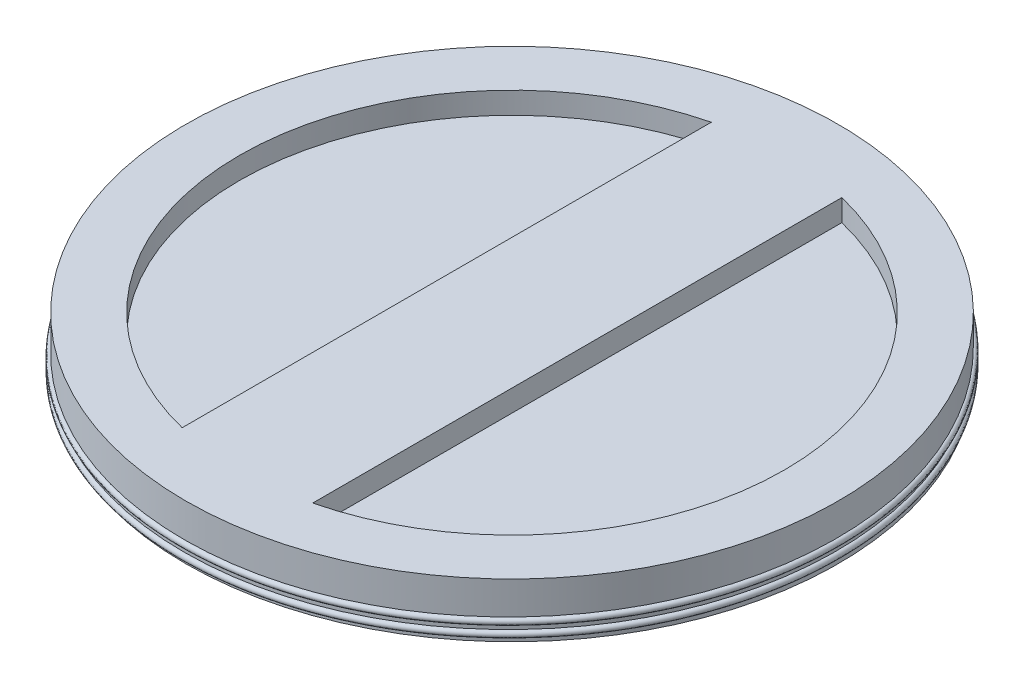
from build123d import *

# Parameters (mm, degrees)
SKETCH_1_R          = 30
EXTRUDE_1_DEPTH     = 5
CUT_EXTRUDE_1_DEPTH = 2
SWEEP_1_PITCH       = 1
SWEEP_1_HEIGHT      = 2
SWEEP_1_RADIUS      = 30
SWEEP_1_START_ANGLE = -90
SKETCH_5_R          = 0.3


with BuildPart() as part:
    # 草图1 → 凸台-拉伸1 (new body)
    with BuildSketch(Plane(origin=(0, 0, 0), x_dir=(1, 0, 0), z_dir=(0, 1, 0))):
        with Locations(Location((0, 0, 0), (0, 0, 270))):
            Circle(SKETCH_1_R)
    extrude(amount=EXTRUDE_1_DEPTH)

    # 草图2 → 切除-拉伸1 (cut)
    with BuildSketch(Plane(origin=(0, 5, 0), x_dir=(1, 0, 0), z_dir=(0, 1, 0))):
        with BuildLine():
            Line((-6, 24.328433654), (-6, -24.328433654))
            ThreePointArc((-6, -24.328433654), (-25.057387814, 0), (-6, 24.328433654))
        make_face()
        with BuildLine():
            Line((6, 24.328433654), (6, -24.328433654))
            ThreePointArc((6, -24.328433654), (25.057387814, 0), (6, 24.328433654))
        make_face()
    extrude(amount=-CUT_EXTRUDE_1_DEPTH, mode=Mode.SUBTRACT)


with BuildPart() as body_2:
    # 扫描1: sweep along a helix
    with BuildLine() as sweep_1_path:
        add(Helix(SWEEP_1_PITCH, SWEEP_1_HEIGHT, SWEEP_1_RADIUS, center=(0, 0, 0), direction=(0, 1, 0), mode=Mode.PRIVATE).rotate(Axis((0, 0, 0), (0, 1, 0)), SWEEP_1_START_ANGLE))
    # 草图5 → 扫描1 (sweep)
    with BuildSketch(Plane.XY):
        with Locations((-30, 0.301836672)):
            Circle(SKETCH_5_R)
    sweep(path=sweep_1_path.line, is_frenet=True)


solid = Compound([part.part, body_2.part])
